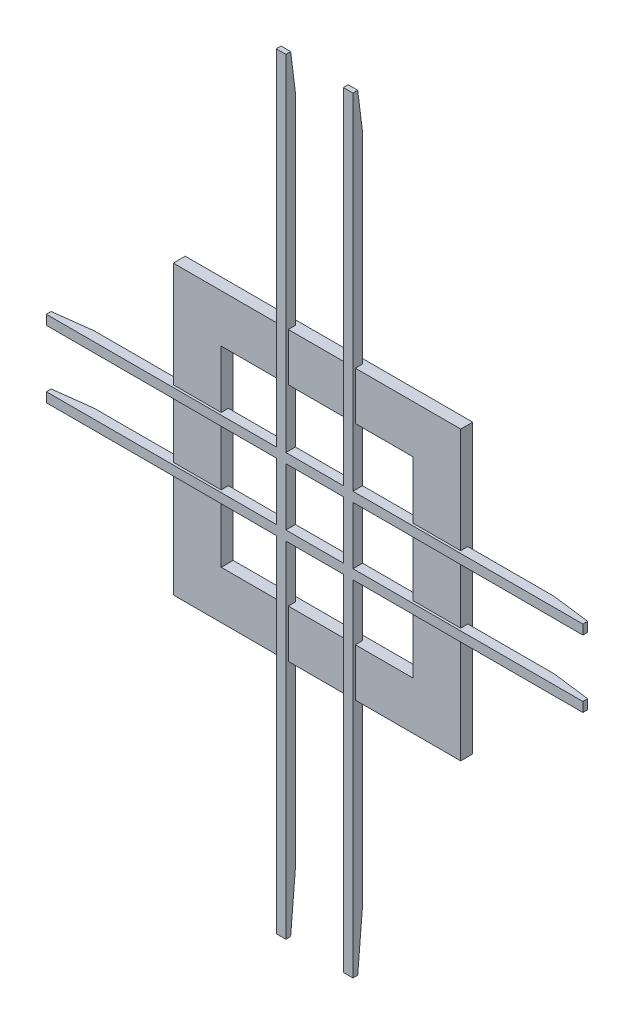
from build123d import *
from OCP.BRepFilletAPI import BRepFilletAPI_MakeChamfer

# Parameters (mm, degrees)
SKETCH1_W           = 31.75
SKETCH1_H           = 38.1
SKETCH1_H_2         = 6.35
SKETCH1_W_2         = 6.35
SKETCH1_H_3         = 31.75
SKETCH1_W_3         = 38.1
BOSS_EXTRUDE1_DEPTH = 4.7625
SKETCH1_4_W         = 6.35
SKETCH1_4_H         = 31.75
SKETCH1_4_W_2       = 38.1
SKETCH1_4_W_3       = 31.75
SKETCH1_4_H_2       = 6.35
SKETCH1_4_H_3       = 38.1
BOSS_EXTRUDE2_DEPTH = 3.175
SKETCH1_5_W         = 38.1
SKETCH1_5_H         = 6.35
SKETCH1_5_W_2       = 63.5
SKETCH1_5_W_3       = 6.35
SKETCH1_5_H_2       = 38.1
SKETCH1_5_W_4       = 19.05
SKETCH1_5_H_3       = 139.7
SKETCH1_5_H_4       = 19.05
SKETCH1_5_H_5       = 158.75
SKETCH1_5_H_6       = 31.75
SKETCH1_5_W_5       = 31.75
BOSS_EXTRUDE3_DEPTH = 6.35
CHAMFER1_SIZE       = 25.4
CHAMFER1_SIZE2      = 3.175
CHAMFER2_SIZE       = 3.175
CHAMFER2_SIZE2      = 25.4
CHAMFER3_SIZE       = 38.1
CHAMFER3_SIZE2      = 3.175


with BuildPart() as part:
    # Sketch1 → Boss-Extrude1 (new body)
    with BuildSketch(Plane.XY):
        Polygon((-63.5, 171.45), (-95.25, 171.45), (-95.25, 101.6), (-25.4, 101.6), (-25.4, 133.35), (-63.5, 133.35), align=None)
        with Locations((-79.375, 196.85)):
            Rectangle(SKETCH1_W, SKETCH1_H)
        with Locations((-79.375, 174.625)):
            Rectangle(SKETCH1_W, SKETCH1_H_2)
        with Locations((-79.375, 219.075)):
            Rectangle(SKETCH1_W, SKETCH1_H_2)
        Polygon((-25.4, 260.35), (-25.4, 292.1), (-95.25, 292.1), (-95.25, 222.25), (-63.5, 222.25), (-63.5, 260.35), align=None)
        with Locations((-22.225, 276.225)):
            Rectangle(SKETCH1_W_2, SKETCH1_H_3)
        with Locations((0, 276.225)):
            Rectangle(SKETCH1_W_3, SKETCH1_H_3)
        with Locations((22.225, 276.225)):
            Rectangle(SKETCH1_W_2, SKETCH1_H_3)
        Polygon((95.25, 292.1), (25.4, 292.1), (25.4, 260.35), (63.5, 260.35), (63.5, 222.25), (95.25, 222.25), align=None)
        with Locations((79.375, 219.075)):
            Rectangle(SKETCH1_W, SKETCH1_H_2)
        with Locations((79.375, 196.85)):
            Rectangle(SKETCH1_W, SKETCH1_H)
        with Locations((79.375, 174.625)):
            Rectangle(SKETCH1_W, SKETCH1_H_2)
        Polygon((95.25, 101.6), (95.25, 171.45), (63.5, 171.45), (63.5, 133.35), (25.4, 133.35), (25.4, 101.6), align=None)
        with Locations((22.225, 117.475)):
            Rectangle(SKETCH1_W_2, SKETCH1_H_3)
        with Locations((0, 117.475)):
            Rectangle(SKETCH1_W_3, SKETCH1_H_3)
        with Locations((-22.225, 117.475)):
            Rectangle(SKETCH1_W_2, SKETCH1_H_3)
    extrude(amount=BOSS_EXTRUDE1_DEPTH)

    # Sketch1<4> → Boss-Extrude2 (add)
    with BuildSketch(Plane.XY):
        Polygon((95.25, 292.1), (25.4, 292.1), (25.4, 260.35), (63.5, 260.35), (63.5, 222.25), (95.25, 222.25), align=None)
        with Locations((22.225, 276.225)):
            Rectangle(SKETCH1_4_W, SKETCH1_4_H)
        with Locations((0, 276.225)):
            Rectangle(SKETCH1_4_W_2, SKETCH1_4_H)
        with Locations((-22.225, 276.225)):
            Rectangle(SKETCH1_4_W, SKETCH1_4_H)
        Polygon((-25.4, 260.35), (-25.4, 292.1), (-95.25, 292.1), (-95.25, 222.25), (-63.5, 222.25), (-63.5, 260.35), align=None)
        with Locations((-79.375, 219.075)):
            Rectangle(SKETCH1_4_W_3, SKETCH1_4_H_2)
        with Locations((-79.375, 196.85)):
            Rectangle(SKETCH1_4_W_3, SKETCH1_4_H_3)
        with Locations((-79.375, 174.625)):
            Rectangle(SKETCH1_4_W_3, SKETCH1_4_H_2)
        Polygon((-63.5, 171.45), (-95.25, 171.45), (-95.25, 101.6), (-25.4, 101.6), (-25.4, 133.35), (-63.5, 133.35), align=None)
        with Locations((-22.225, 117.475)):
            Rectangle(SKETCH1_4_W, SKETCH1_4_H)
        with Locations((0, 117.475)):
            Rectangle(SKETCH1_4_W_2, SKETCH1_4_H)
        Polygon((95.25, 101.6), (95.25, 171.45), (63.5, 171.45), (63.5, 133.35), (25.4, 133.35), (25.4, 101.6), align=None)
        with Locations((22.225, 117.475)):
            Rectangle(SKETCH1_4_W, SKETCH1_4_H)
        with Locations((79.375, 174.625)):
            Rectangle(SKETCH1_4_W_3, SKETCH1_4_H_2)
        with Locations((79.375, 196.85)):
            Rectangle(SKETCH1_4_W_3, SKETCH1_4_H_3)
        with Locations((79.375, 219.075)):
            Rectangle(SKETCH1_4_W_3, SKETCH1_4_H_2)
    extrude(amount=-BOSS_EXTRUDE2_DEPTH)

    # Sketch1<5> → Boss-Extrude3 (add)
    with BuildSketch(Plane.XY):
        with Locations((44.45, 219.075)):
            Rectangle(SKETCH1_5_W, SKETCH1_5_H)
        with Locations((127, 219.075)):
            Rectangle(SKETCH1_5_W_2, SKETCH1_5_H)
        with Locations((22.225, 219.075)):
            Rectangle(SKETCH1_5_W_3, SKETCH1_5_H)
        with Locations((0, 219.075)):
            Rectangle(SKETCH1_5_W, SKETCH1_5_H)
        with Locations((-22.225, 219.075)):
            Rectangle(SKETCH1_5_W_3, SKETCH1_5_H)
        with Locations((-44.45, 219.075)):
            Rectangle(SKETCH1_5_W, SKETCH1_5_H)
        with Locations((-22.225, 241.3)):
            Rectangle(SKETCH1_5_W_3, SKETCH1_5_H_2)
        with Locations((22.225, 241.3)):
            Rectangle(SKETCH1_5_W_3, SKETCH1_5_H_2)
        with Locations((22.225, 196.85)):
            Rectangle(SKETCH1_5_W_3, SKETCH1_5_H_2)
        with Locations((-22.225, 196.85)):
            Rectangle(SKETCH1_5_W_3, SKETCH1_5_H_2)
        with Locations((-22.225, 174.625)):
            Rectangle(SKETCH1_5_W_3, SKETCH1_5_H)
        with Locations((0, 174.625)):
            Rectangle(SKETCH1_5_W, SKETCH1_5_H)
        with Locations((22.225, 174.625)):
            Rectangle(SKETCH1_5_W_3, SKETCH1_5_H)
        with Locations((44.45, 174.625)):
            Rectangle(SKETCH1_5_W, SKETCH1_5_H)
        with Locations((22.225, 152.4)):
            Rectangle(SKETCH1_5_W_3, SKETCH1_5_H_2)
        with Locations((-22.225, 152.4)):
            Rectangle(SKETCH1_5_W_3, SKETCH1_5_H_2)
        with Locations((-44.45, 174.625)):
            Rectangle(SKETCH1_5_W, SKETCH1_5_H)
        with Locations((-127, 219.075)):
            Rectangle(SKETCH1_5_W_2, SKETCH1_5_H)
        with Locations((-127, 174.625)):
            Rectangle(SKETCH1_5_W_2, SKETCH1_5_H)
        with Locations((-168.275, 174.625)):
            Rectangle(SKETCH1_5_W_4, SKETCH1_5_H)
        with Locations((-168.275, 219.075)):
            Rectangle(SKETCH1_5_W_4, SKETCH1_5_H)
        with Locations((-22.225, 361.95)):
            Rectangle(SKETCH1_5_W_3, SKETCH1_5_H_3)
        with Locations((22.225, 361.95)):
            Rectangle(SKETCH1_5_W_3, SKETCH1_5_H_3)
        with Locations((22.225, 441.325)):
            Rectangle(SKETCH1_5_W_3, SKETCH1_5_H_4)
        with Locations((-22.225, 441.325)):
            Rectangle(SKETCH1_5_W_3, SKETCH1_5_H_4)
        with Locations((127, 174.625)):
            Rectangle(SKETCH1_5_W_2, SKETCH1_5_H)
        with Locations((168.275, 219.075)):
            Rectangle(SKETCH1_5_W_4, SKETCH1_5_H)
        with Locations((168.275, 174.625)):
            Rectangle(SKETCH1_5_W_4, SKETCH1_5_H)
        with Locations((22.225, 22.225)):
            Rectangle(SKETCH1_5_W_3, SKETCH1_5_H_5)
        with Locations((-22.225, 22.225)):
            Rectangle(SKETCH1_5_W_3, SKETCH1_5_H_5)
        with Locations((-22.225, 117.475)):
            Rectangle(SKETCH1_5_W_3, SKETCH1_5_H_6)
        with Locations((22.225, 117.475)):
            Rectangle(SKETCH1_5_W_3, SKETCH1_5_H_6)
        with Locations((-79.375, 174.625)):
            Rectangle(SKETCH1_5_W_5, SKETCH1_5_H)
        with Locations((-79.375, 219.075)):
            Rectangle(SKETCH1_5_W_5, SKETCH1_5_H)
        with Locations((-22.225, 276.225)):
            Rectangle(SKETCH1_5_W_3, SKETCH1_5_H_6)
        with Locations((22.225, 276.225)):
            Rectangle(SKETCH1_5_W_3, SKETCH1_5_H_6)
        with Locations((79.375, 219.075)):
            Rectangle(SKETCH1_5_W_5, SKETCH1_5_H)
        with Locations((79.375, 174.625)):
            Rectangle(SKETCH1_5_W_5, SKETCH1_5_H)
    extrude(amount=BOSS_EXTRUDE3_DEPTH)

    # Chamfer1: one chamfer whose edges measure the first distance from different faces: ONE call of the kernel's chamfer builder (chamfer() names one face for all edges)
    chamfer1_edges_1 = [part.edges().sort_by_distance(p)[0] for p in [
        (22.225, 450.85, 0),
    ]]
    chamfer1_side_1 = [part.faces().sort_by_distance(p)[0] for p in [
        (22.225, 371.475, 0),
    ]]
    chamfer1_edges_2 = [part.edges().sort_by_distance(p)[0] for p in [
        (-22.225, 450.85, 0),
    ]]
    chamfer1_side_2 = [part.faces().sort_by_distance(p)[0] for p in [
        (-22.225, 371.475, 0),
    ]]
    chamfer1_edges_3 = [part.edges().sort_by_distance(p)[0] for p in [
        (-177.8, 219.075, 0),
    ]]
    chamfer1_side_3 = [part.faces().sort_by_distance(p)[0] for p in [
        (-136.525, 219.075, 0),
    ]]
    chamfer1_edges_4 = [part.edges().sort_by_distance(p)[0] for p in [
        (-177.8, 174.625, 0),
    ]]
    chamfer1_side_4 = [part.faces().sort_by_distance(p)[0] for p in [
        (-136.525, 174.625, 0),
    ]]
    chamfer1 = BRepFilletAPI_MakeChamfer(part.part.solid().wrapped)
    for e in chamfer1_edges_1:
        chamfer1.Add(CHAMFER1_SIZE, CHAMFER1_SIZE2, e.wrapped, chamfer1_side_1[0].wrapped)  # the first distance lies on this face
    for e in chamfer1_edges_2:
        chamfer1.Add(CHAMFER1_SIZE, CHAMFER1_SIZE2, e.wrapped, chamfer1_side_2[0].wrapped)  # the first distance lies on this face
    for e in chamfer1_edges_3:
        chamfer1.Add(CHAMFER1_SIZE, CHAMFER1_SIZE2, e.wrapped, chamfer1_side_3[0].wrapped)  # the first distance lies on this face
    for e in chamfer1_edges_4:
        chamfer1.Add(CHAMFER1_SIZE, CHAMFER1_SIZE2, e.wrapped, chamfer1_side_4[0].wrapped)  # the first distance lies on this face
    add(Compound.cast(chamfer1.Shape()), mode=Mode.REPLACE)

    # Chamfer2: one chamfer whose edges measure the first distance from different faces: ONE call of the kernel's chamfer builder (chamfer() names one face for all edges)
    chamfer2_edges_1 = [part.edges().sort_by_distance(p)[0] for p in [
        (177.8, 219.075, 0),
    ]]
    chamfer2_side_1 = [part.faces().sort_by_distance(p)[0] for p in [
        (177.8, 219.075, 3.175),
    ]]
    chamfer2_edges_2 = [part.edges().sort_by_distance(p)[0] for p in [
        (177.8, 174.625, 0),
    ]]
    chamfer2_side_2 = [part.faces().sort_by_distance(p)[0] for p in [
        (177.8, 174.625, 3.175),
    ]]
    chamfer2 = BRepFilletAPI_MakeChamfer(part.part.solid().wrapped)
    for e in chamfer2_edges_1:
        chamfer2.Add(CHAMFER2_SIZE, CHAMFER2_SIZE2, e.wrapped, chamfer2_side_1[0].wrapped)  # the first distance lies on this face
    for e in chamfer2_edges_2:
        chamfer2.Add(CHAMFER2_SIZE, CHAMFER2_SIZE2, e.wrapped, chamfer2_side_2[0].wrapped)  # the first distance lies on this face
    add(Compound.cast(chamfer2.Shape()), mode=Mode.REPLACE)

    # Chamfer3: one chamfer whose edges measure the first distance from different faces: ONE call of the kernel's chamfer builder (chamfer() names one face for all edges)
    chamfer3_edges_1 = [part.edges().sort_by_distance(p)[0] for p in [
        (-22.225, -57.15, 0),
    ]]
    chamfer3_side_1 = [part.faces().sort_by_distance(p)[0] for p in [
        (-22.225, 22.225, 0),
    ]]
    chamfer3_edges_2 = [part.edges().sort_by_distance(p)[0] for p in [
        (22.225, -57.15, 0),
    ]]
    chamfer3_side_2 = [part.faces().sort_by_distance(p)[0] for p in [
        (22.225, 22.225, 0),
    ]]
    chamfer3 = BRepFilletAPI_MakeChamfer(part.part.solid().wrapped)
    for e in chamfer3_edges_1:
        chamfer3.Add(CHAMFER3_SIZE, CHAMFER3_SIZE2, e.wrapped, chamfer3_side_1[0].wrapped)  # the first distance lies on this face
    for e in chamfer3_edges_2:
        chamfer3.Add(CHAMFER3_SIZE, CHAMFER3_SIZE2, e.wrapped, chamfer3_side_2[0].wrapped)  # the first distance lies on this face
    add(Compound.cast(chamfer3.Shape()), mode=Mode.REPLACE)


solid = part.part
